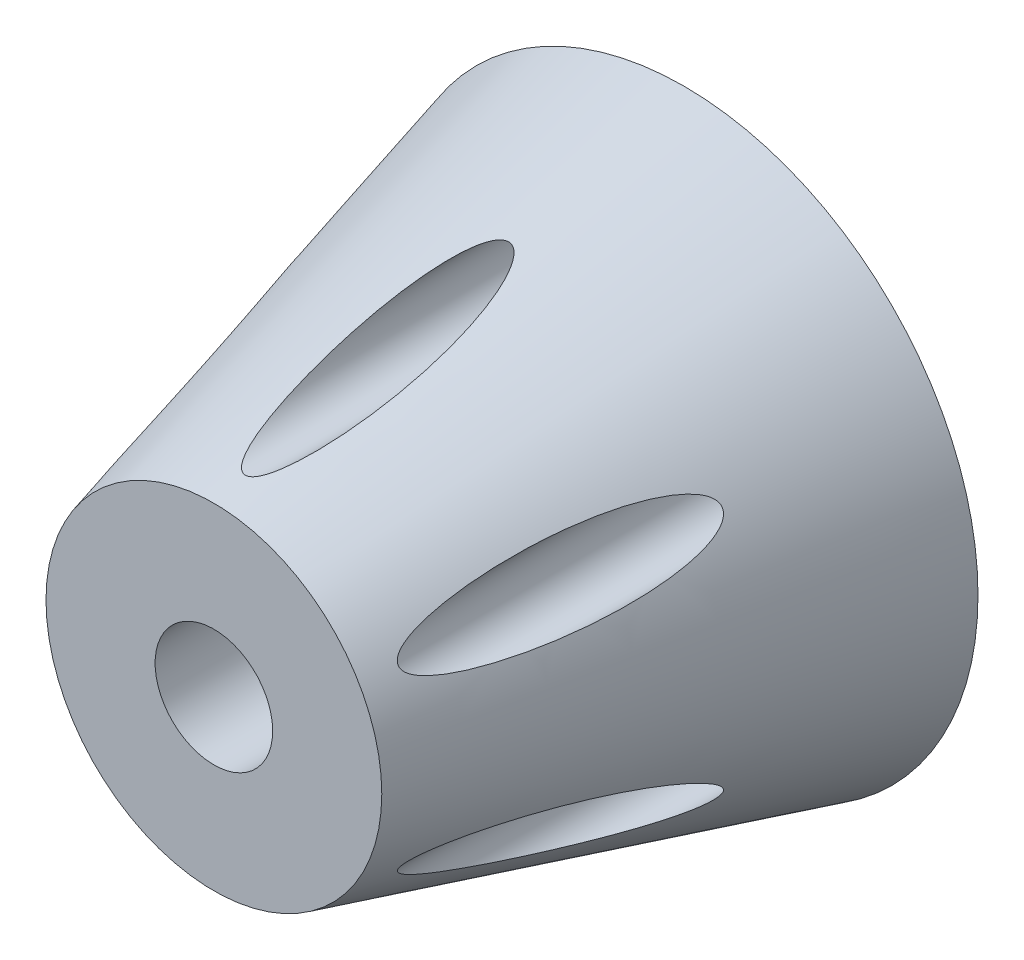
from build123d import *

# Parameters (mm, degrees)
SKETCH2_R           = 125
BOSS_EXTRUDE1_DEPTH = 200
BOSS_EXTRUDE1_TAPER = 15
SKETCH3_R           = 25
CUT_EXTRUDE1_DEPTH  = 267.926956301
SKETCH4_R           = 5
CUT_EXTRUDE2_DEPTH  = 267.926956301
CUT_EXTRUDE3_START  = -50
SKETCH5_R           = 15
CUT_EXTRUDE3_DEPTH  = 217.926956469


with BuildPart() as part:
    # Sketch2 → Boss-Extrude1 (new body)
    with BuildSketch(Plane.XY):
        Circle(SKETCH2_R)
    extrude(amount=BOSS_EXTRUDE1_DEPTH, taper=BOSS_EXTRUDE1_TAPER)

    # Sketch3 → Cut-Extrude1 (cut, through all)
    with BuildSketch(Plane.XY.offset(200)):
        Circle(SKETCH3_R)
    extrude(amount=-CUT_EXTRUDE1_DEPTH, mode=Mode.SUBTRACT)

    # Sketch4 → Cut-Extrude2 (cut, through all)
    with BuildSketch(Plane(origin=(0, 0, 0), x_dir=(-1, 0, 0), z_dir=(0, 0, -1))):
        with Locations((0, 90)):
            Circle(SKETCH4_R)
        with Locations((77.942286341, 45)):
            Circle(SKETCH4_R)
        with Locations((77.942286341, -45)):
            Circle(SKETCH4_R)
        with Locations((0, -90)):
            Circle(SKETCH4_R)
        with Locations((-77.942286341, -45)):
            Circle(SKETCH4_R)
        with Locations((-77.942286341, 45)):
            Circle(SKETCH4_R)
    extrude(amount=-CUT_EXTRUDE2_DEPTH, mode=Mode.SUBTRACT)

    # Sketch5 → Cut-Extrude3 (cut, through all)
    with BuildSketch(Plane(origin=(0, 0, 0), x_dir=(-1, 0, 0), z_dir=(0, 0, -1)).offset(CUT_EXTRUDE3_START)):
        with Locations((0, 90)):
            Circle(SKETCH5_R)
        with Locations((77.942286341, 45)):
            Circle(SKETCH5_R)
        with Locations((77.942286341, -45)):
            Circle(SKETCH5_R)
        with Locations((0, -90)):
            Circle(SKETCH5_R)
        with Locations((-77.942286341, -45)):
            Circle(SKETCH5_R)
        with Locations((-77.942286341, 45)):
            Circle(SKETCH5_R)
    extrude(amount=-CUT_EXTRUDE3_DEPTH, mode=Mode.SUBTRACT)


solid = part.part
